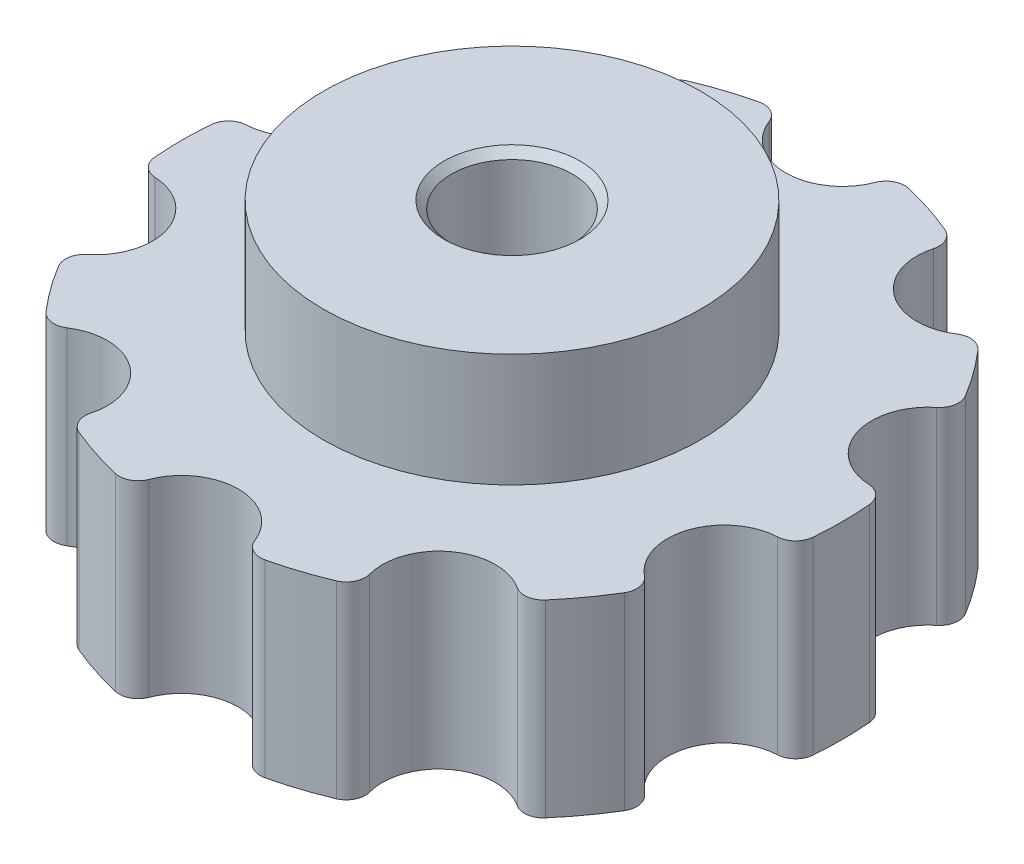
from build123d import *

# Parameters (mm, degrees)
SKETCH1_R           = 8.75
BOSS_EXTRUDE1_DEPTH = 5
SKETCH2_R           = 1.5
CUT_EXTRUDE1_DEPTH  = 14.346347815
FILLET1_R           = 0.5
SKETCH3_R           = 5
BOSS_EXTRUDE2_DEPTH = 3
CUT_EXTRUDE2_DEPTH  = 3
SKETCH5_R           = 1.6
CUT_EXTRUDE3_DEPTH  = 15.608933005
CHAMFER1_SIZE       = 0.2


with BuildPart() as part:
    # Sketch1 → Boss-Extrude1 (new body)
    with BuildSketch(Plane(origin=(0, 0, 0), x_dir=(1, 0, 0), z_dir=(0, 1, 0))):
        with Locations(Location((0, 0, 0), (0, 0, 270))):
            Circle(SKETCH1_R)
    extrude(amount=BOSS_EXTRUDE1_DEPTH)

    # Sketch2 → Cut-Extrude1 (cut, through all)
    with BuildSketch(Plane(origin=(0, 5, 0), x_dir=(1, 0, 0), z_dir=(0, 1, 0))):
        with Locations((0, 8.75)):
            Circle(SKETCH2_R)
        with Locations((5.143120958, 7.078898701)):
            Circle(SKETCH2_R)
        with Locations((8.321744518, 2.703898701)):
            Circle(SKETCH2_R)
        with Locations((8.321744518, -2.703898701)):
            Circle(SKETCH2_R)
        with Locations((5.143120958, -7.078898701)):
            Circle(SKETCH2_R)
        with Locations((0, -8.75)):
            Circle(SKETCH2_R)
        with Locations((-5.143120958, -7.078898701)):
            Circle(SKETCH2_R)
        with Locations((-8.321744518, -2.703898701)):
            Circle(SKETCH2_R)
        with Locations((-8.321744518, 2.703898701)):
            Circle(SKETCH2_R)
        with Locations((-5.143120958, 7.078898701)):
            Circle(SKETCH2_R)
    extrude(amount=-CUT_EXTRUDE1_DEPTH, mode=Mode.SUBTRACT)

    # Fillet1
    fillet1_edges = [part.edges().sort_by_distance(p)[0] for p in [
        (6.276607993, 2.5, -6.096449139),
        (3.858489143, 2.5, -7.853315321),
        (8.661285428, 2.5, -1.242833346),
        (7.737646217, 2.5, -4.085502542),
        (7.737646217, 2.5, 4.085502542),
        (8.661285428, 2.5, 1.242833346),
        (3.858489143, 2.5, 7.853315321),
        (6.276607993, 2.5, 6.096449139),
        (-1.494479638, 2.5, 8.621428571),
        (1.494479638, 2.5, 8.621428571),
        (-6.276607993, 2.5, 6.096449139),
        (-3.858489143, 2.5, 7.853315321),
        (-8.661285428, 2.5, 1.242833346),
        (-7.737646217, 2.5, 4.085502542),
        (-7.737646217, 2.5, -4.085502542),
        (-8.661285428, 2.5, -1.242833346),
        (-3.858489143, 2.5, -7.853315321),
        (-6.276607993, 2.5, -6.096449139),
        (1.494479638, 2.5, -8.621428571),
        (-1.494479638, 2.5, -8.621428571),
    ]]
    fillet(fillet1_edges, radius=FILLET1_R)

    # Sketch3 → Boss-Extrude2 (add)
    with BuildSketch(Plane(origin=(0, 5, 0), x_dir=(1, 0, 0), z_dir=(0, 1, 0))):
        with Locations(Location((0, 0, 0), (0, 0, 270))):
            Circle(SKETCH3_R)
    extrude(amount=BOSS_EXTRUDE2_DEPTH)

    # Sketch4 → Cut-Extrude2 (cut)
    with BuildSketch(Plane.XZ):
        Polygon((2.749630657, 1.5875), (0, 3.175), (-2.749630657, 1.5875), (-2.749630657, -1.5875), (0, -3.175), (2.749630657, -1.5875), align=None)
    extrude(amount=-CUT_EXTRUDE2_DEPTH, mode=Mode.SUBTRACT)

    # Sketch5 → Cut-Extrude3 (cut, through all)
    with BuildSketch(Plane(origin=(0, 8, 0), x_dir=(1, 0, 0), z_dir=(0, 1, 0))):
        with Locations(Location((0, 0, 0), (0, 0, 270))):
            Circle(SKETCH5_R)
    extrude(amount=-CUT_EXTRUDE3_DEPTH, mode=Mode.SUBTRACT)

    # Chamfer1
    chamfer1_edges = [part.edges().sort_by_distance(p)[0] for p in [
        (0, 8, -1.6),
    ]]
    chamfer(chamfer1_edges, length=CHAMFER1_SIZE)


solid = part.part
